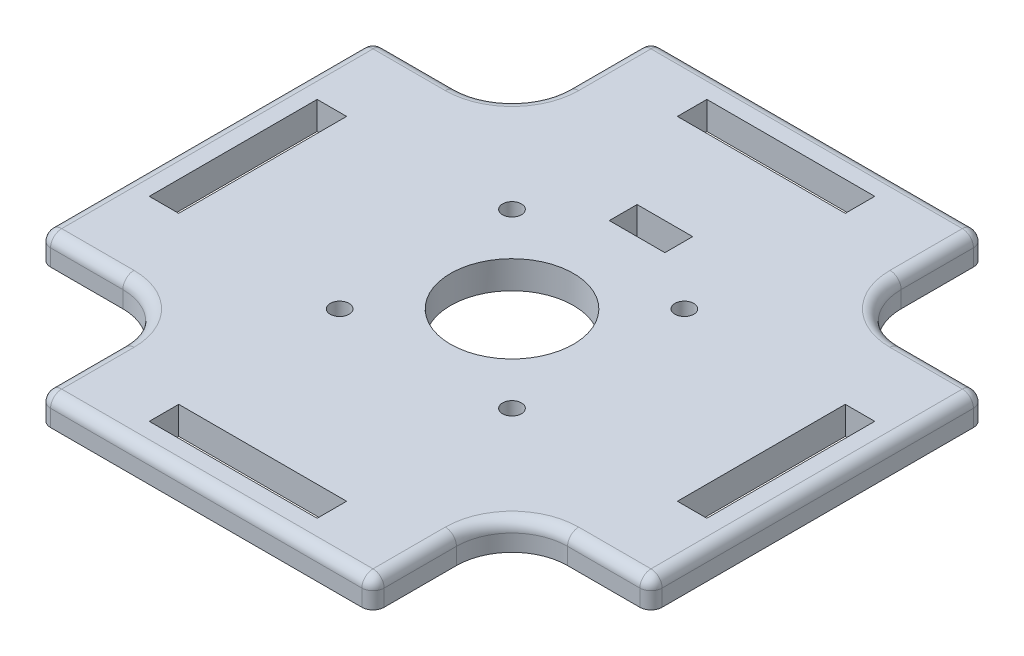
from build123d import *

# Parameters (mm, degrees)
BOSS_EXTRUDE1_DEPTH                                  = 5
CUT_EXTRUDE1_REACH                                   = 79.942
SKETCH2_R                                            = 11.05
SKETCH2_W                                            = 5.3
SKETCH2_H                                            = 30.2
CIRPATTERN1_COUNT                                    = 4
CBORE_FOR_M3_HEX_SOCKET_THIN_HEAD_CAP_SC_D           = 3.4
CBORE_FOR_M3_HEX_SOCKET_THIN_HEAD_CAP_SC_CBORE_D     = 6.5
CBORE_FOR_M3_HEX_SOCKET_THIN_HEAD_CAP_SC_CBORE_DEPTH = 2.4
FILLET1_R                                            = 10
FILLET2_R                                            = 2
FILLET3_R                                            = 2
CUT_EXTRUDE2_REACH                                   = 79.942
SKETCH6_W                                            = 10
SKETCH6_H                                            = 5


with BuildPart() as part:
    # Sketch1 → Boss-Extrude1 (new body)
    with BuildSketch(Plane(origin=(0, 0, 0), x_dir=(1, 0, 0), z_dir=(0, 1, 0))):
        Polygon((-30, 55), (30, 55), (30, 30), (55, 30), (55, -30), (30, -30), (30, -55), (-30, -55), (-30, -30), (-55, -30), (-55, 30), (-30, 30), align=None)
    extrude(amount=BOSS_EXTRUDE1_DEPTH)

    # Sketch2 → Cut-Extrude1 (cut, up to next)
    with BuildSketch(Plane(origin=(0, 5, 0), x_dir=(1, 0, 0), z_dir=(0, 1, 0)), mode=Mode.PRIVATE) as cut_extrude1_sk1:
        with Locations(Location((0, 0, 0), (0, 0, 270))):
            Circle(SKETCH2_R)
    cut_extrude1_tool1 = extrude(cut_extrude1_sk1.sketch, amount=-CUT_EXTRUDE1_REACH, mode=Mode.PRIVATE) & part.part
    # Sketch2 → Cut-Extrude1 (cut, up to next)
    with BuildSketch(Plane(origin=(0, 5, 0), x_dir=(1, 0, 0), z_dir=(0, 1, 0)), mode=Mode.PRIVATE) as cut_extrude1_sk2:
        with Locations((-47.5, 0)):
            Rectangle(SKETCH2_W, SKETCH2_H)
    cut_extrude1_tool2 = extrude(cut_extrude1_sk2.sketch, amount=-CUT_EXTRUDE1_REACH, mode=Mode.PRIVATE) & part.part
    cut_extrude1_1 = cut_extrude1_tool1.solids().sort_by_distance((0, 5, 0))[0]
    add(cut_extrude1_1, mode=Mode.SUBTRACT)
    cut_extrude1_2 = cut_extrude1_tool2.solids().sort_by_distance((-47.5, 5, 0))[0]
    add(cut_extrude1_2, mode=Mode.SUBTRACT)
    cut_extrude1 = cut_extrude1_1 + cut_extrude1_2  # Cut-Extrude1 as one shape, for the pattern or mirror that repeats it

    # CirPattern1: Cut-Extrude1 ×4 about axis
    cirpattern1_axis = Axis((0, 0, 0), (0, 1, 0))
    for i in range(1, CIRPATTERN1_COUNT):
        add(cut_extrude1.rotate(cirpattern1_axis, i * 360 / CIRPATTERN1_COUNT), mode=Mode.SUBTRACT)

    # CBORE for M3 Hex Socket Thin Head Cap Screw1 (through all)
    with Locations(Plane(origin=(-15.5, 0, 15.5), x_dir=(0, 0, -1), z_dir=(0, -1, 0))):
        with Locations((0, 0), (31, 0), (31, 31), (0, 31)):
            CounterBoreHole(CBORE_FOR_M3_HEX_SOCKET_THIN_HEAD_CAP_SC_D / 2, CBORE_FOR_M3_HEX_SOCKET_THIN_HEAD_CAP_SC_CBORE_D / 2, CBORE_FOR_M3_HEX_SOCKET_THIN_HEAD_CAP_SC_CBORE_DEPTH)

    # Fillet1
    fillet1_edges = [part.edges().sort_by_distance(p)[0] for p in [
        (30, 2.5, -30),
        (30, 2.5, 30),
        (-30, 2.5, 30),
        (-30, 2.5, -30),
    ]]
    fillet(fillet1_edges, radius=FILLET1_R)

    # Fillet2
    fillet2_edges = [part.edges().sort_by_distance(p)[0] for p in [
        (-30, 2.5, -55),
        (30, 2.5, -55),
        (55, 2.5, -30),
        (55, 2.5, 30),
        (30, 2.5, 55),
        (-30, 2.5, 55),
        (-55, 2.5, 30),
        (-55, 2.5, -30),
    ]]
    fillet(fillet2_edges, radius=FILLET2_R)

    # Fillet3
    fillet3_edges = [part.edges().sort_by_distance(p)[0] for p in [
        (-46.5, 5, -30),
        (30, 5, -46.5),
        (46.5, 5, 30),
        (-30, 5, 46.5),
        (-32.928932188, 5, -32.928932188),
        (32.928932188, 5, -32.928932188),
        (32.928932188, 5, 32.928932188),
        (-32.928932188, 5, 32.928932188),
        (-55, 5, 0),
        (-30, 5, -46.5),
        (-46.5, 5, 30),
        (0, 5, 55),
        (30, 5, 46.5),
        (55, 5, 0),
        (46.5, 5, -30),
        (0, 5, -55),
        (-29.414213562, 5, -54.414213562),
        (54.414213562, 5, -29.414213562),
        (29.414213562, 5, -54.414213562),
        (29.414213562, 5, 54.414213562),
        (54.414213562, 5, 29.414213562),
        (-54.414213562, 5, 29.414213562),
        (-29.414213562, 5, 54.414213562),
        (-54.414213562, 5, -29.414213562),
    ]]
    fillet(fillet3_edges, radius=FILLET3_R)

    # Sketch6 → Cut-Extrude2 (cut, up to next)
    with BuildSketch(Plane(origin=(0, 5, 0), x_dir=(1, 0, 0), z_dir=(0, 1, 0)), mode=Mode.PRIVATE) as cut_extrude2_sk1:
        with Locations((0, 25)):
            Rectangle(SKETCH6_W, SKETCH6_H)
    cut_extrude2_tool1 = extrude(cut_extrude2_sk1.sketch, amount=-CUT_EXTRUDE2_REACH, mode=Mode.PRIVATE) & part.part
    add(cut_extrude2_tool1.solids().sort_by_distance((0, 5, -25))[0], mode=Mode.SUBTRACT)


solid = part.part
